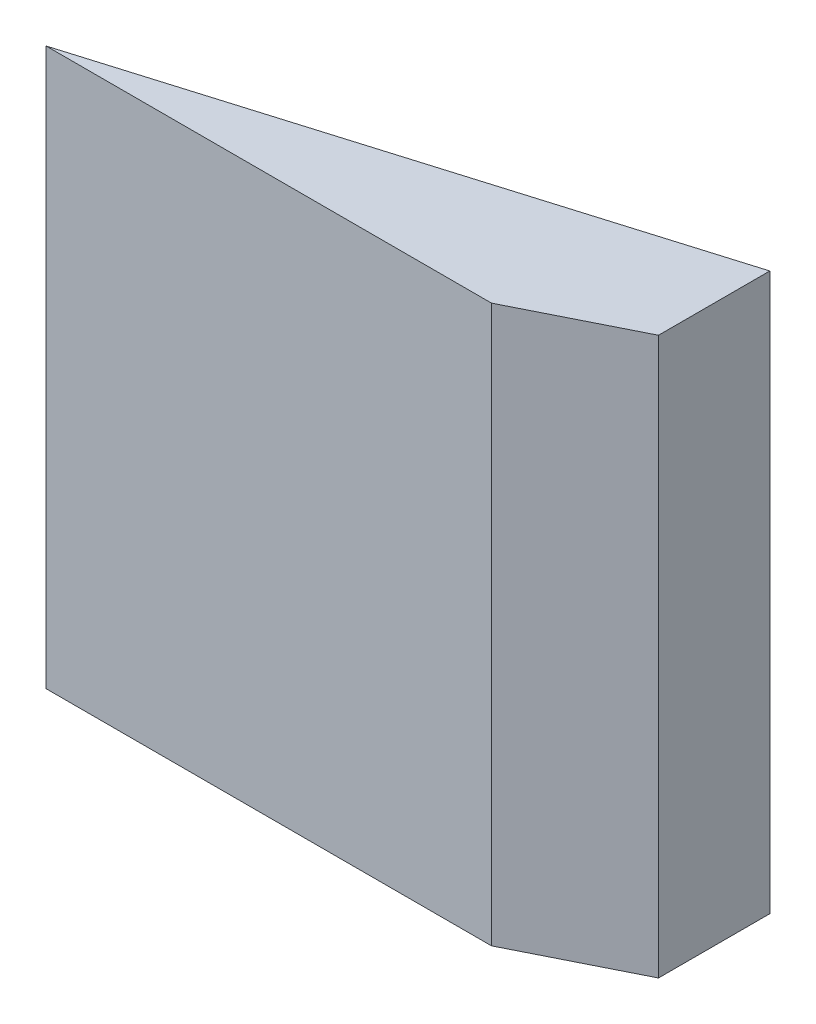
from build123d import *

# Parameters (mm, degrees)
BOSS_EXTRUDE1_DEPTH = 25


with BuildPart() as part:
    # Sketch1 → Boss-Extrude1 (new body)
    with BuildSketch(Plane(origin=(0, 0, 0), x_dir=(1, 0, 0), z_dir=(0, 1, 0))):
        Polygon((0, 0), (25, 7.5), (25, 2.5), (20, 0), align=None)
    extrude(amount=BOSS_EXTRUDE1_DEPTH)


solid = part.part
